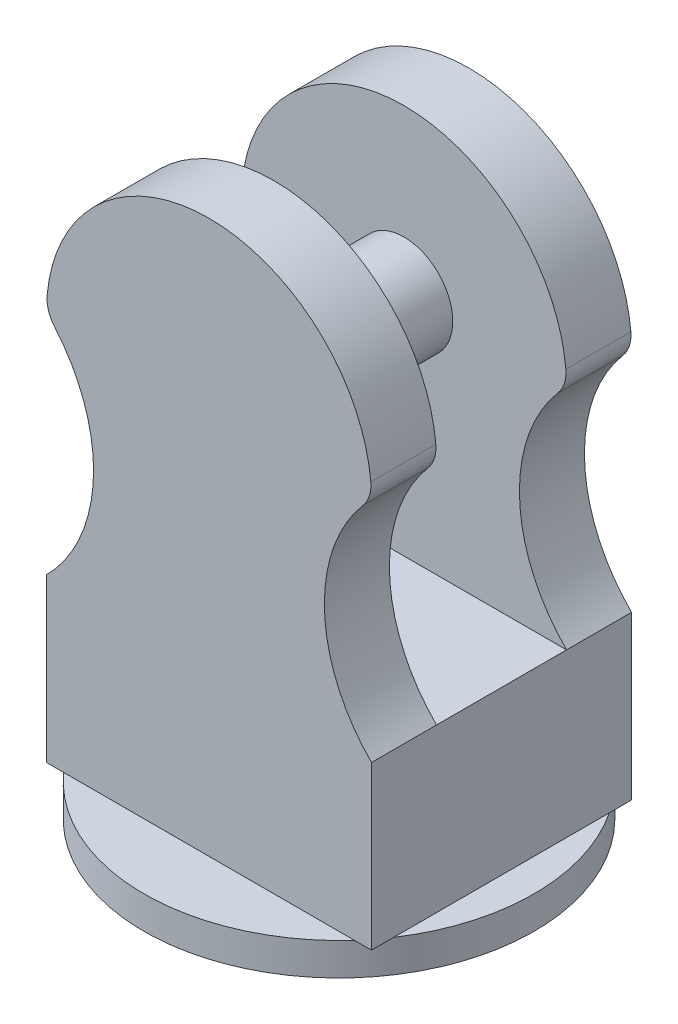
from build123d import *

# Parameters (mm, degrees)
SKETCH1_R           = 15
BOSS_EXTRUDE1_DEPTH = 40
BOSS_EXTRUDE2_DEPTH = 20
BOSS_EXTRUDE3_START = -20
BOSS_EXTRUDE3_DEPTH = 20
SKETCH4_W           = 100
SKETCH4_H           = 50
BOSS_EXTRUDE4_DEPTH = 80
SKETCH5_R           = 60
BOSS_EXTRUDE5_DEPTH = 10
SKETCH6_R           = 15
CUT_EXTRUDE1_DEPTH  = 10
CUT_EXTRUDE2_DEPTH  = 90
CUT_EXTRUDE3_DEPTH  = 90
FILLET2_R           = 10


with BuildPart() as part:
    # Sketch1 → Boss-Extrude1 (new, symmetric)
    with BuildSketch(Plane.XY):
        Circle(SKETCH1_R)
    extrude(amount=BOSS_EXTRUDE1_DEPTH, both=True)

    # Sketch2 → Boss-Extrude2 (add)
    with BuildSketch(Plane.XY.offset(40)):
        with BuildLine():
            Line((50, 0), (50, -70))
            ThreePointArc((50, -70), (0, -120), (-50, -70))
            Line((-50, -70), (-50, 0))
            ThreePointArc((-50, 0), (0, 50), (50, 0))
        make_face()
    extrude(amount=-BOSS_EXTRUDE2_DEPTH)

    # Sketch3 → Boss-Extrude3 (add)
    with BuildSketch(Plane(origin=(0, 0, -40), x_dir=(-1, 0, 0), z_dir=(0, 0, -1)).offset(BOSS_EXTRUDE3_START)):
        with BuildLine():
            Line((50, 0), (50, -70))
            ThreePointArc((50, -70), (0, -120), (-50, -70))
            Line((-50, -70), (-50, 0))
            ThreePointArc((-50, 0), (0, 50), (50, 0))
        make_face()
    extrude(amount=BOSS_EXTRUDE3_DEPTH)

    # Sketch4 → Boss-Extrude4 (add)
    with BuildSketch(Plane(origin=(0, 0, -40), x_dir=(-1, 0, 0), z_dir=(0, 0, -1))):
        with Locations((0, -95)):
            Rectangle(SKETCH4_W, SKETCH4_H)
    extrude(amount=-BOSS_EXTRUDE4_DEPTH)

    # Sketch5 → Boss-Extrude5 (add)
    with BuildSketch(Plane.XZ.offset(120)):
        with Locations(Location((0, 0, 0), (0, 0, 41.810314896))):
            Circle(SKETCH5_R)
    extrude(amount=BOSS_EXTRUDE5_DEPTH)

    # Sketch6 → Cut-Extrude1 (cut)
    with BuildSketch(Plane.XZ.offset(130)):
        with Locations(Location((0, 0, 0), (0, 0, 270))):
            Circle(SKETCH6_R)
    extrude(amount=-CUT_EXTRUDE1_DEPTH, mode=Mode.SUBTRACT)

    # Sketch7 → Cut-Extrude2 (cut)
    with BuildSketch(Plane.XY.offset(40)):
        with BuildLine():
            Line((-50, -70), (-50, 0))
            ThreePointArc((-50, 0), (-35.502525317, -35), (-50, -70))
        make_face()
    extrude(amount=-CUT_EXTRUDE2_DEPTH, mode=Mode.SUBTRACT)

    # Sketch8 → Cut-Extrude3 (cut)
    with BuildSketch(Plane.XY.offset(40)):
        with BuildLine():
            Line((50, -70), (50, 0))
            ThreePointArc((50, 0), (35.502525317, -35), (50, -70))
        make_face()
    extrude(amount=-CUT_EXTRUDE3_DEPTH, mode=Mode.SUBTRACT)

    # Fillet2
    fillet2_edges = [part.edges().sort_by_distance(p)[0] for p in [
        (50, 0, -30),
        (-50, 0, -30),
        (-50, 0, 30),
        (50, 0, 30),
    ]]
    fillet(fillet2_edges, radius=FILLET2_R)


solid = part.part
